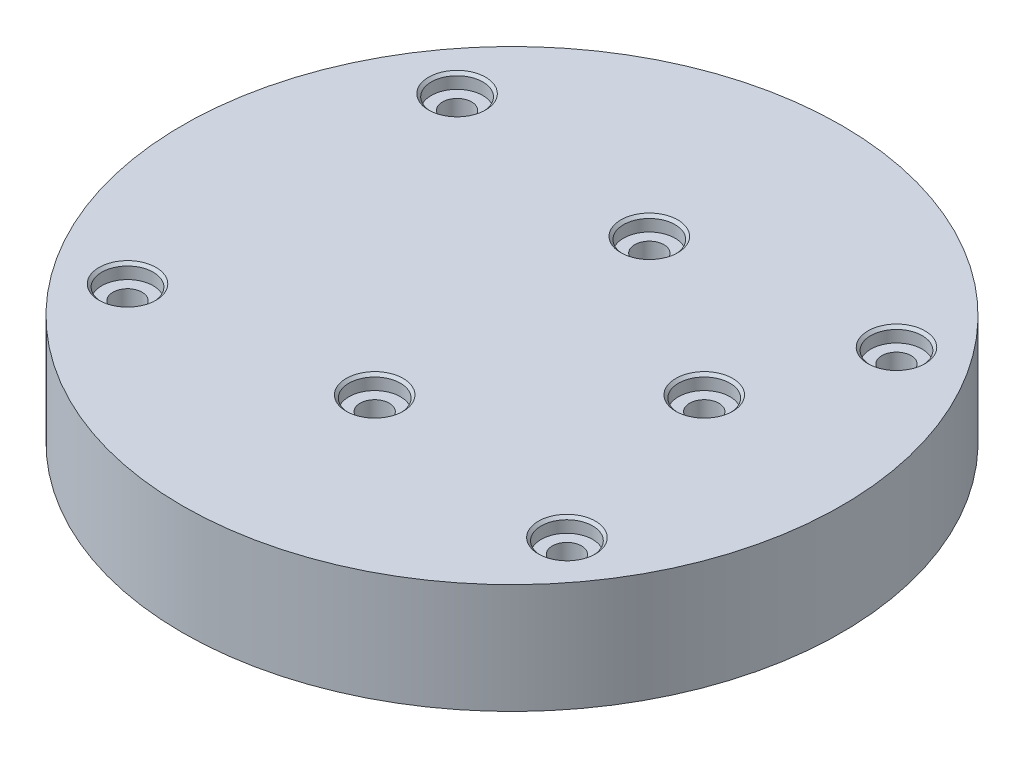
from build123d import *

# Parameters (mm, degrees)
SKETCH1_R                                     = 76.2
BOSS_EXTRUDE1_DEPTH                           = 25.4
CBORE_FOR_1_4_BUTTON_HEAD_CAP_SCREW1_AT_COUNT = 2
CBORE_FOR_1_4_BUTTON_HEAD_CAP_SCREW1_AT_PITCH = 45.790501198
CBORE_FOR_1_4_BUTTON_HEAD_CAP_SCREW1_2_COUNT  = 2
CBORE_FOR_1_4_BUTTON_HEAD_CAP_SCREW1_2_PITCH  = 63.5
CBORE_FOR_1_4_BUTTON_HEAD_CAP_SCREW1_3_COUNT  = 2
CBORE_FOR_1_4_BUTTON_HEAD_CAP_SCREW1_3_PITCH  = 86.36933773
CBORE_FOR_1_4_BUTTON_HEAD_CAP_SCREW1_4_COUNT  = 2
CBORE_FOR_1_4_BUTTON_HEAD_CAP_SCREW1_4_PITCH  = 51.195336702
CBORE_FOR_1_4_BUTTON_HEAD_CAP_SCREW1_5_COUNT  = 2
CBORE_FOR_1_4_BUTTON_HEAD_CAP_SCREW1_5_PITCH  = 51.195336702
CBORE_FOR_1_4_BUTTON_HEAD_CAP_SCREW1_6_COUNT  = 2
CBORE_FOR_1_4_BUTTON_HEAD_CAP_SCREW1_6_PITCH  = 86.36933773


with BuildPart() as part:
    # Sketch1 → Boss-Extrude1 (new body)
    with BuildSketch(Plane(origin=(0, 0, 0), x_dir=(1, 0, 0), z_dir=(0, 1, 0))):
        with Locations(Location((0, 0, 0), (0, 0, 270))):
            Circle(SKETCH1_R)
    extrude(amount=-BOSS_EXTRUDE1_DEPTH)

    # Sketch8 → CBORE for 1/4 Button Head Cap Screw1 (revolve, cut)
    with BuildSketch(Plane(origin=(0, 0, -31.75), x_dir=(0, 0, 1), z_dir=(1, 0, 0))):
        Polygon((0, 0), (0, 25.4), (3.3782, 25.4), (3.3782, 3.3528), (5.95376, 3.3528), (5.95376, 0.635), (6.58876, 0), align=None)
    cbore_for_1_4_button_head_cap_screw1 = revolve(axis=Axis((0, 6.35, -31.75), (0, -1, 0)), mode=Mode.SUBTRACT)

    # CBORE for 1/4 Button Head Cap Screw1 at: CBORE for 1/4 Button Head Cap Screw1 ×2
    with Locations(*[Vector(0.8320502943378437, 0, 0.5547001962252293) * (i * CBORE_FOR_1_4_BUTTON_HEAD_CAP_SCREW1_AT_PITCH) for i in range(1, CBORE_FOR_1_4_BUTTON_HEAD_CAP_SCREW1_AT_COUNT)]):
        add(cbore_for_1_4_button_head_cap_screw1, mode=Mode.SUBTRACT)

    # CBORE for 1_4 Button Head Cap Screw1 2: CBORE for 1/4 Button Head Cap Screw1 ×2
    with Locations(*[(0, 0, i * CBORE_FOR_1_4_BUTTON_HEAD_CAP_SCREW1_2_PITCH) for i in range(1, CBORE_FOR_1_4_BUTTON_HEAD_CAP_SCREW1_2_COUNT)]):
        add(cbore_for_1_4_button_head_cap_screw1, mode=Mode.SUBTRACT)

    # CBORE for 1_4 Button Head Cap Screw1 3: CBORE for 1/4 Button Head Cap Screw1 ×2
    with Locations(*[Vector(0.5881716976750462, 0, 0.8087360843031886) * (i * CBORE_FOR_1_4_BUTTON_HEAD_CAP_SCREW1_3_PITCH) for i in range(1, CBORE_FOR_1_4_BUTTON_HEAD_CAP_SCREW1_3_COUNT)]):
        add(cbore_for_1_4_button_head_cap_screw1, mode=Mode.SUBTRACT)

    # CBORE for 1_4 Button Head Cap Screw1 4: CBORE for 1/4 Button Head Cap Screw1 ×2
    with Locations(*[Vector(0.9922778767136676, 0, -0.12403473458920865) * (i * CBORE_FOR_1_4_BUTTON_HEAD_CAP_SCREW1_4_PITCH) for i in range(1, CBORE_FOR_1_4_BUTTON_HEAD_CAP_SCREW1_4_COUNT)]):
        add(cbore_for_1_4_button_head_cap_screw1, mode=Mode.SUBTRACT)

    # CBORE for 1_4 Button Head Cap Screw1 5: CBORE for 1/4 Button Head Cap Screw1 ×2
    with Locations(*[Vector(-0.9922778767136676, 0, -0.12403473458920862) * (i * CBORE_FOR_1_4_BUTTON_HEAD_CAP_SCREW1_5_PITCH) for i in range(1, CBORE_FOR_1_4_BUTTON_HEAD_CAP_SCREW1_5_COUNT)]):
        add(cbore_for_1_4_button_head_cap_screw1, mode=Mode.SUBTRACT)

    # CBORE for 1_4 Button Head Cap Screw1 6: CBORE for 1/4 Button Head Cap Screw1 ×2
    with Locations(*[Vector(-0.5881716976750463, 0, 0.8087360843031884) * (i * CBORE_FOR_1_4_BUTTON_HEAD_CAP_SCREW1_6_PITCH) for i in range(1, CBORE_FOR_1_4_BUTTON_HEAD_CAP_SCREW1_6_COUNT)]):
        add(cbore_for_1_4_button_head_cap_screw1, mode=Mode.SUBTRACT)


solid = part.part
